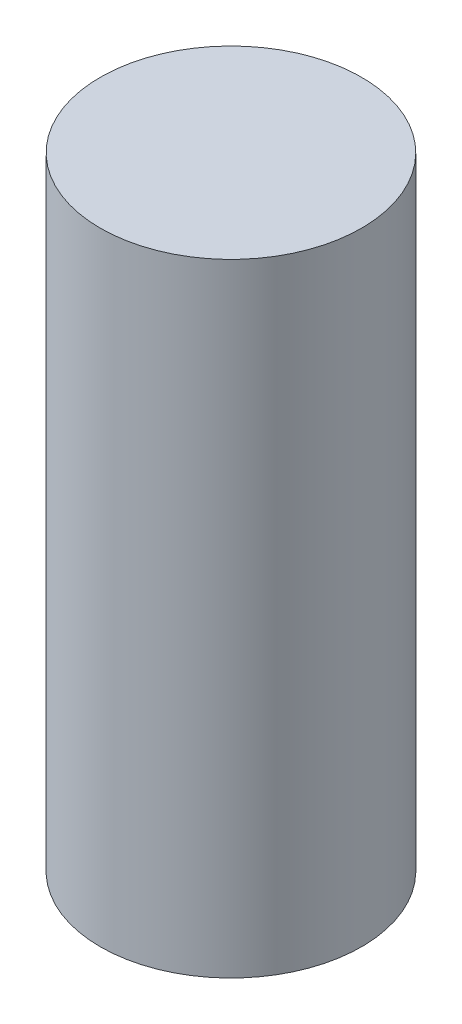
from build123d import *

# Parameters (mm, degrees)
SKETCH1_R           = 10.5
BOSS_EXTRUDE1_DEPTH = 50


with BuildPart() as part:
    # Sketch1 → Boss-Extrude1 (new body)
    with BuildSketch(Plane(origin=(0, 0, 0), x_dir=(1, 0, 0), z_dir=(0, 1, 0))):
        with Locations(Location((0, 0, 0), (0, 0, 270))):
            Circle(SKETCH1_R)
    extrude(amount=BOSS_EXTRUDE1_DEPTH)


solid = part.part
